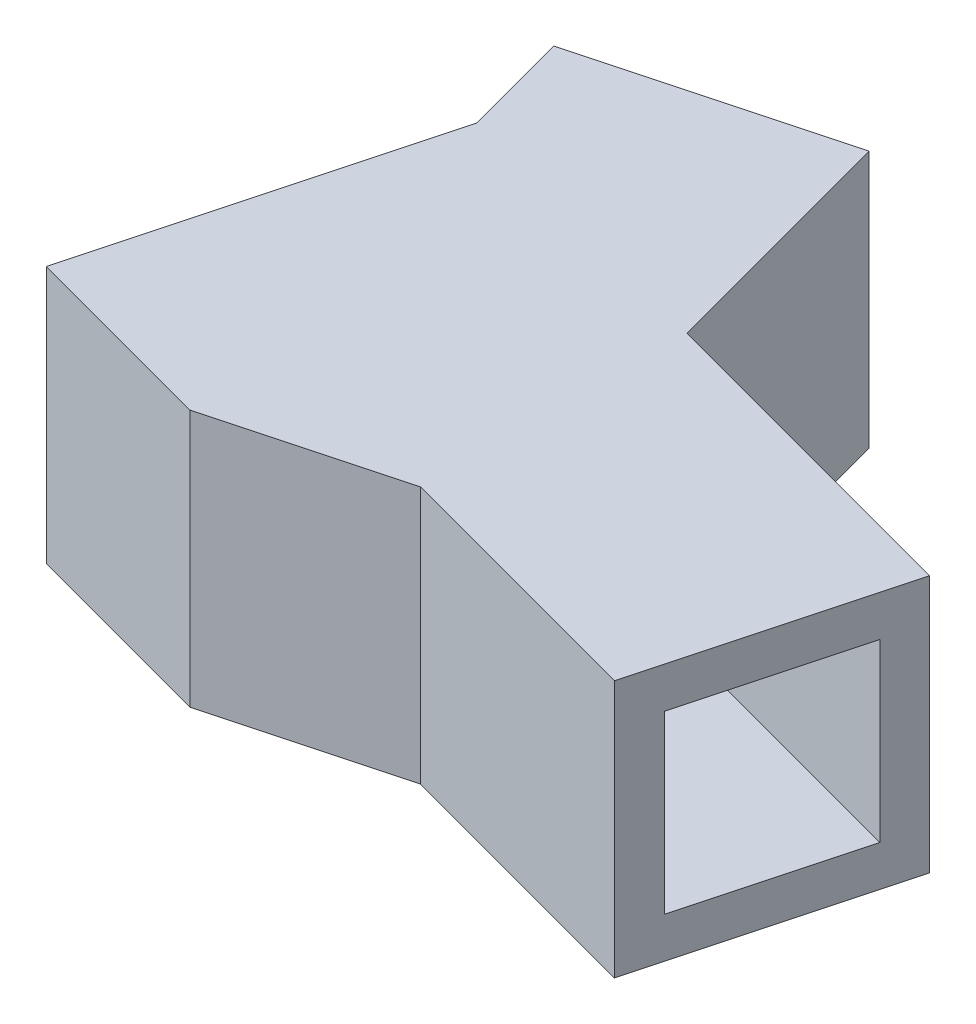
from build123d import *

# Parameters (mm, degrees)
BOSS_EXTRUDE1_DEPTH = 15
SKETCH2_W           = 10.25
SKETCH2_H           = 10.25
CUT_EXTRUDE1_DEPTH  = 18
SKETCH3_W           = 10.25
SKETCH3_H           = 10.25
CUT_EXTRUDE2_DEPTH  = 17
CUT_EXTRUDE3_REACH  = 41.336
SKETCH4_W           = 8
SKETCH4_H           = 8
CUT_EXTRUDE4_REACH  = 34.317
SKETCH5_W           = 8
SKETCH5_H           = 8
FILLET1_R           = 6
FILLET2_R           = 3
BOSS_EXTRUDE2_DEPTH = 15


with BuildPart() as part:
    # Sketch1 → Boss-Extrude1 (new body)
    with BuildSketch(Plane(origin=(0, 0, 0), x_dir=(1, 0, 0), z_dir=(0, 1, 0))):
        Polygon((0, 0), (15.436230849, -4.13612559), (19.318516526, 10.352761804), (0, 15.529142706), (-3.882285677, 30.0180301), (-18.371173071, 26.135744424), (-10.606601718, -2.842030365), align=None)
    extrude(amount=BOSS_EXTRUDE1_DEPTH)

    # Sketch2 → Cut-Extrude1 (cut)
    with BuildSketch(Plane(origin=(15.436230849, 0, 4.13612559), x_dir=(0.2588190451025214, 0, -0.9659258262890681), z_dir=(0.9659258262890681, 0, 0.2588190451025214))):
        with Locations((7.5, 7.5)):
            Rectangle(SKETCH2_W, SKETCH2_H)
    extrude(amount=-CUT_EXTRUDE1_DEPTH, mode=Mode.SUBTRACT)

    # Sketch3 → Cut-Extrude2 (cut)
    with BuildSketch(Plane(origin=(-7.764571353, 0, -28.977774789), x_dir=(-0.9659258262890682, 0, 0.2588190451025212), z_dir=(-0.2588190451025212, 0, -0.9659258262890682))):
        with Locations((3.480762114, 7.5)):
            Rectangle(SKETCH3_W, SKETCH3_H)
    extrude(amount=-CUT_EXTRUDE2_DEPTH, mode=Mode.SUBTRACT)

    # Cut-Extrude3: up to this plane
    cut_extrude3_end = Plane(origin=(-11.677175467, 12.625, -10.329700609), z_dir=(-0.9659258262890682, 0, 0.2588190451025212))
    # Sketch4 → Cut-Extrude3 (cut, up to the surface)
    with BuildSketch(Plane(origin=(-1.950434024, 0, -0.522617222), x_dir=(0.25881904510252146, 0, -0.9659258262890681), z_dir=(0.9659258262890681, 0, 0.25881904510252146)), mode=Mode.PRIVATE) as cut_extrude3_sk1:
        with Locations((7.5, 7.5)):
            Rectangle(SKETCH4_W, SKETCH4_H)
    cut_extrude3_tool1 = split(extrude(cut_extrude3_sk1.sketch, amount=-CUT_EXTRUDE3_REACH, mode=Mode.PRIVATE), bisect_by=cut_extrude3_end, keep=Keep.BOTH, mode=Mode.PRIVATE)
    add(cut_extrude3_tool1.solids().sort_by_distance((-0.009291, 7.5, -7.767061))[0], mode=Mode.SUBTRACT)

    # Cut-Extrude4: up to this face of the body (flat: up to its plane)
    cut_extrude4_end = Plane(part.part.faces().sort_by_distance((-5.844526251, 7.5, -5.189502721))[0])
    # Sketch5 → Cut-Extrude4 (cut, up to the picked face)
    with BuildSketch(Plane(origin=(-3.364647586, 0, -12.557035742), x_dir=(-0.9659258262890682, 0, 0.25881904510252124), z_dir=(-0.25881904510252124, 0, -0.9659258262890682)), mode=Mode.PRIVATE) as cut_extrude4_sk1:
        with Locations((3.480762114, 7.5)):
            Rectangle(SKETCH5_W, SKETCH5_H)
    cut_extrude4_tool1 = split(extrude(cut_extrude4_sk1.sketch, amount=-CUT_EXTRUDE4_REACH, mode=Mode.PRIVATE), bisect_by=cut_extrude4_end, keep=Keep.BOTH, mode=Mode.PRIVATE)
    add(cut_extrude4_tool1.solids().sort_by(Axis((-6.726806, 7.5, -11.656148), (0.25881904510252124, 0, 0.9659258262890682)))[0], mode=Mode.SUBTRACT)

    # Fillet1
    fillet1_edges = [part.edges().sort_by_distance(p)[0] for p in [
        (-10.644485136, 7.5, -6.475647828),
    ]]
    fillet(fillet1_edges, radius=FILLET1_R)

    # Fillet2
    fillet2_edges = [part.edges().sort_by_distance(p)[0] for p in [
        (-11.609118038, 11.5, -10.075706826),
        (-0.915876519, 11.5, -12.151084448),
        (-0.915876519, 3.5, -12.151084448),
        (-11.609118038, 3.5, -10.075706826),
        (-4.171493644, 3.5, -4.741214984),
        (-9.988146338, 3.5, -7.131986626),
        (-4.171493644, 11.5, -4.741214984),
        (-9.988146338, 11.5, -7.131986626),
    ]]
    fillet(fillet2_edges, radius=FILLET2_R)

    # Sketch6 → Boss-Extrude2 (add)
    with BuildSketch(Plane(origin=(0, 15, 0), x_dir=(1, 0, 0), z_dir=(0, 1, 0))):
        Polygon((-10.606601718, -2.842030365), (-22.033626934, 0.219831814), (-16.730326075, 20.012020067), align=None)
    extrude(amount=-BOSS_EXTRUDE2_DEPTH)


solid = part.part
